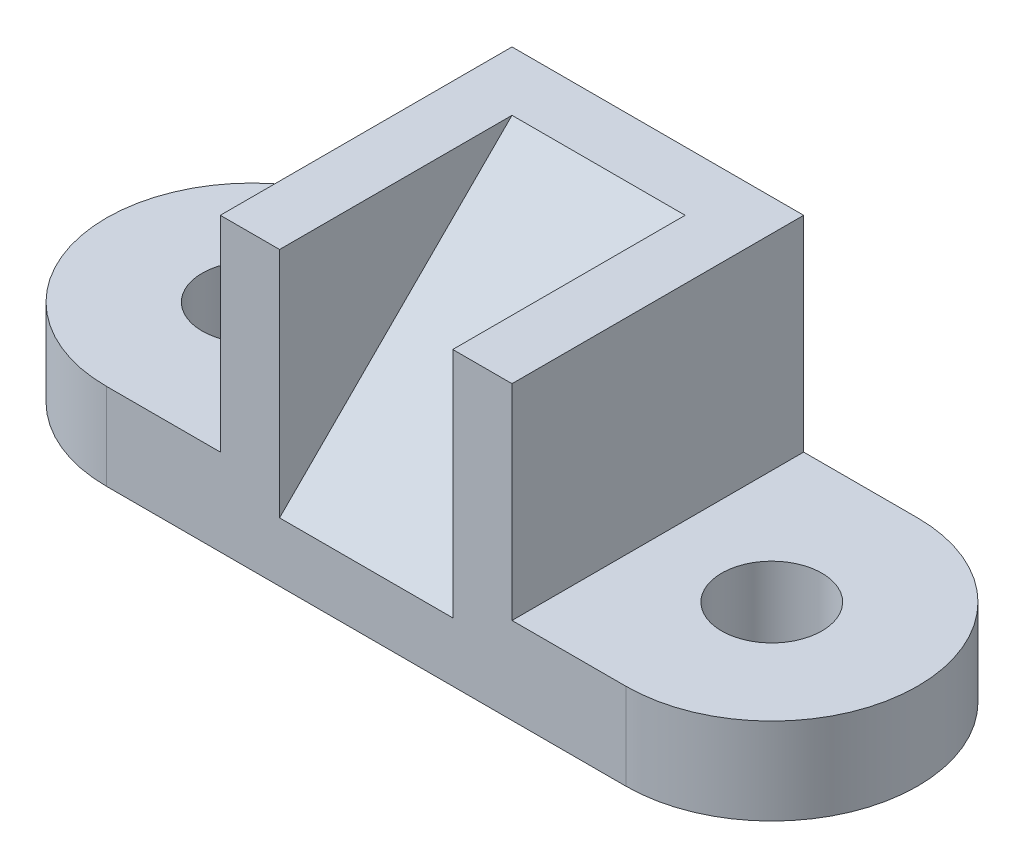
from build123d import *

# Parameters (mm, degrees)
SKETCH1_R           = 11
SKETCH1_W           = 64
SKETCH1_H           = 64
BOSS_EXTRUDE1_DEPTH = 19
SKETCH2_W           = 64
SKETCH2_H           = 64
BOSS_EXTRUDE2_DEPTH = 45
SKETCH3_W           = 38
SKETCH3_H           = 51
CUT_EXTRUDE1_DEPTH  = 51
BOSS_EXTRUDE3_DEPTH = 38


with BuildPart() as part:
    # Sketch1 → Boss-Extrude1 (new body)
    # profile 1 of 3: a face of its own
    with BuildSketch(Plane(origin=(0, 0, 0), x_dir=(1, 0, 0), z_dir=(0, 1, 0))):
        with BuildLine():
            Line((-32, 32), (-57, 32))
            ThreePointArc((-57, 32), (-89, 0), (-57, -32))
            Line((-57, -32), (-32, -32))
            Line((-32, -32), (-32, 32))
        make_face()
        with Locations(Location((-57, 0, 0), (0, 0, 270))):
            Circle(SKETCH1_R, mode=Mode.SUBTRACT)
    # profile 2 of 3: a face of its own
    with BuildSketch(Plane(origin=(0, 0, 0), x_dir=(1, 0, 0), z_dir=(0, 1, 0))):
        Rectangle(SKETCH1_W, SKETCH1_H)
    # profile 3 of 3: a face of its own
    with BuildSketch(Plane(origin=(0, 0, 0), x_dir=(1, 0, 0), z_dir=(0, 1, 0))):
        with BuildLine():
            ThreePointArc((57, 32), (89, 0), (57, -32))
            Line((57, -32), (32, -32))
            Line((32, -32), (32, 32))
            Line((32, 32), (57, 32))
        make_face()
        with Locations(Location((57, 0, 0), (0, 0, 270))):
            Circle(SKETCH1_R, mode=Mode.SUBTRACT)
    extrude(amount=BOSS_EXTRUDE1_DEPTH)

    # Sketch2 → Boss-Extrude2 (add)
    with BuildSketch(Plane(origin=(0, 19, 0), x_dir=(1, 0, 0), z_dir=(0, 1, 0))):
        Rectangle(SKETCH2_W, SKETCH2_H)
    extrude(amount=BOSS_EXTRUDE2_DEPTH)

    # Sketch3 → Cut-Extrude1 (cut)
    with BuildSketch(Plane(origin=(0, 64, 0), x_dir=(1, 0, 0), z_dir=(0, 1, 0))):
        with Locations((0, -6.5)):
            Rectangle(SKETCH3_W, SKETCH3_H)
    extrude(amount=-CUT_EXTRUDE1_DEPTH, mode=Mode.SUBTRACT)

    # Sketch4 → Boss-Extrude3 (add)
    with BuildSketch(Plane.ZY.offset(-19)):
        Polygon((-19, 64), (32, 13), (-19, 13), align=None)
    extrude(amount=BOSS_EXTRUDE3_DEPTH)


solid = part.part
